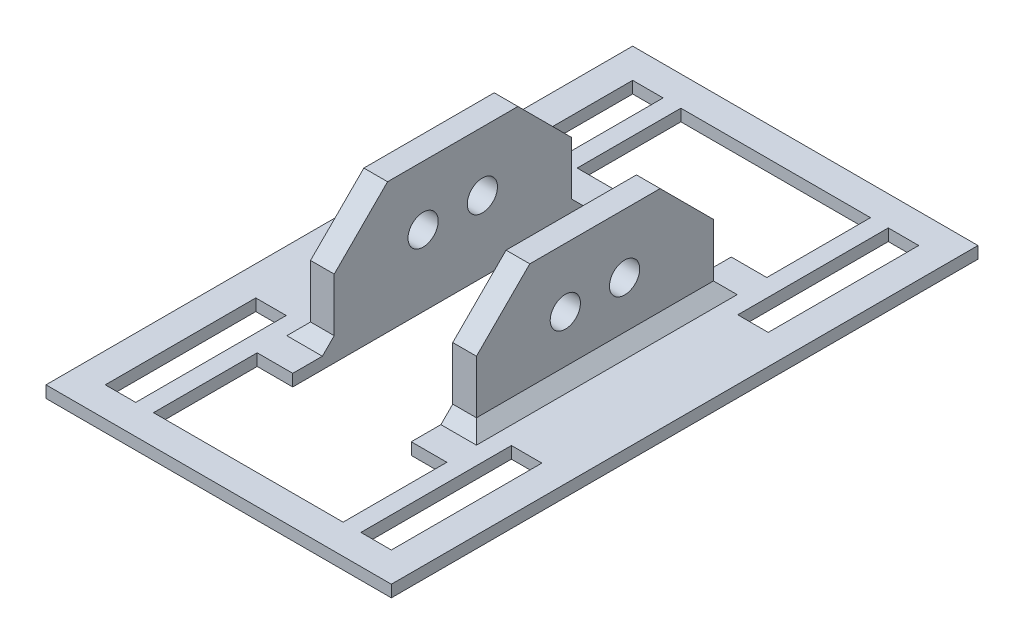
from build123d import *

# Parameters (mm, degrees)
SKETCH1_W           = 58.28
SKETCH1_H           = 99
SKETCH1_W_2         = 5.14
SKETCH1_H_2         = 25.4
BOSS_EXTRUDE1_DEPTH = 2
SKETCH2_W           = 4
SKETCH2_H           = 40
BOSS_EXTRUDE2_DEPTH = 20
CUT_EXTRUDE1_REACH  = 107.741
SKETCH3_R           = 2.55
CHAMFER1_SIZE       = 2
CUT_EXTRUDE2_REACH  = 107.741
CUT_EXTRUDE3_DEPTH  = 2


with BuildPart() as part:
    # Sketch1 → Boss-Extrude1 (new body)
    with BuildSketch(Plane(origin=(0, 0, 0), x_dir=(1, 0, 0), z_dir=(0, 1, 0))):
        with Locations((24.14, 44.5)):
            Rectangle(SKETCH1_W, SKETCH1_H)
        with Locations((2.57, 76.3)):
            Rectangle(SKETCH1_W_2, SKETCH1_H_2, mode=Mode.SUBTRACT)
        with Locations((45.71, 76.3)):
            Rectangle(SKETCH1_W_2, SKETCH1_H_2, mode=Mode.SUBTRACT)
        with Locations((2.57, 12.7)):
            Rectangle(SKETCH1_W_2, SKETCH1_H_2, mode=Mode.SUBTRACT)
        with Locations((45.71, 12.7)):
            Rectangle(SKETCH1_W_2, SKETCH1_H_2, mode=Mode.SUBTRACT)
    extrude(amount=BOSS_EXTRUDE1_DEPTH)

    # Sketch2 → Boss-Extrude2 (add)
    with BuildSketch(Plane(origin=(0, 2, 0), x_dir=(1, 0, 0), z_dir=(0, 1, 0))):
        with Locations((12.14, 44.5)):
            Rectangle(SKETCH2_W, SKETCH2_H)
        with Locations((36.14, 44.5)):
            Rectangle(SKETCH2_W, SKETCH2_H)
    extrude(amount=BOSS_EXTRUDE2_DEPTH)

    # Cut-Extrude1: up to this face of the body (flat: up to its plane)
    cut_extrude1_end = Plane(part.part.faces().sort_by_distance((10.14, 12, -44.5))[0])
    # Sketch3 → Cut-Extrude1 (cut, up to the picked face)
    with BuildSketch(Plane(origin=(38.14, 0, 0), x_dir=(0, 0, -1), z_dir=(1, 0, 0)), mode=Mode.PRIVATE) as cut_extrude1_sk1:
        with Locations((39.5, 12)):
            Circle(SKETCH3_R)
    cut_extrude1_tool1 = split(extrude(cut_extrude1_sk1.sketch, amount=-CUT_EXTRUDE1_REACH, mode=Mode.PRIVATE), bisect_by=cut_extrude1_end, keep=Keep.BOTH, mode=Mode.PRIVATE)
    # Sketch3 → Cut-Extrude1 (cut, up to the picked face)
    with BuildSketch(Plane(origin=(38.14, 0, 0), x_dir=(0, 0, -1), z_dir=(1, 0, 0)), mode=Mode.PRIVATE) as cut_extrude1_sk2:
        with Locations((49.5, 12)):
            Circle(SKETCH3_R)
    cut_extrude1_tool2 = split(extrude(cut_extrude1_sk2.sketch, amount=-CUT_EXTRUDE1_REACH, mode=Mode.PRIVATE), bisect_by=cut_extrude1_end, keep=Keep.BOTH, mode=Mode.PRIVATE)
    add(cut_extrude1_tool1.solids().sort_by(Axis((38.14, 12, -39.5), (-1, 0, 0)))[0], mode=Mode.SUBTRACT)
    add(cut_extrude1_tool2.solids().sort_by(Axis((38.14, 12, -49.5), (-1, 0, 0)))[0], mode=Mode.SUBTRACT)

    # Chamfer1
    chamfer1_edges = [part.edges().sort_by_distance(p)[0] for p in [
        (12.14, 2, -64.5),
        (10.14, 2, -44.5),
        (12.14, 2, -24.5),
        (36.14, 2, -24.5),
        (38.14, 2, -44.5),
        (36.14, 2, -64.5),
    ]]
    chamfer(chamfer1_edges, length=CHAMFER1_SIZE)

    # Cut-Extrude2: up to this face of the body (flat: up to its plane)
    cut_extrude2_end = Plane(part.part.faces().sort_by_distance((38.14, 13.060158725, -44.5))[0])
    # Sketch4 → Cut-Extrude2 (cut, up to the picked face)
    with BuildSketch(Plane.ZY.offset(-10.14), mode=Mode.PRIVATE) as cut_extrude2_sk1:
        Polygon((-55.5, 22), (-64.5, 13), (-64.5, 22), align=None)
    cut_extrude2_tool1 = split(extrude(cut_extrude2_sk1.sketch, amount=-CUT_EXTRUDE2_REACH, mode=Mode.PRIVATE), bisect_by=cut_extrude2_end, keep=Keep.BOTH, mode=Mode.PRIVATE)
    # Sketch4 → Cut-Extrude2 (cut, up to the picked face)
    with BuildSketch(Plane.ZY.offset(-10.14), mode=Mode.PRIVATE) as cut_extrude2_sk2:
        Polygon((-33.5, 22), (-24.5, 13), (-24.5, 22), align=None)
    cut_extrude2_tool2 = split(extrude(cut_extrude2_sk2.sketch, amount=-CUT_EXTRUDE2_REACH, mode=Mode.PRIVATE), bisect_by=cut_extrude2_end, keep=Keep.BOTH, mode=Mode.PRIVATE)
    add(cut_extrude2_tool1.solids().sort_by(Axis((10.14, 19, -61.5), (1, 0, 0)))[0], mode=Mode.SUBTRACT)
    add(cut_extrude2_tool2.solids().sort_by(Axis((10.14, 19, -27.5), (1, 0, 0)))[0], mode=Mode.SUBTRACT)

    # Sketch5 → Cut-Extrude3 (cut)
    with BuildSketch(Plane(origin=(0, 2, 0), x_dir=(1, 0, 0), z_dir=(0, 1, 0))):
        Polygon((34.14, 22.5), (34.14, 66.5), (34.14, 71.5), (40.14, 71.5), (40.14, 89), (8.14, 89), (8.14, 71.5), (14.14, 71.5), (14.14, 66.5), (14.14, 22.5), (14.14, 17.5), (8.14, 17.5), (8.14, 0), (40.14, 0), (40.14, 17.5), (34.14, 17.5), align=None)
    extrude(amount=-CUT_EXTRUDE3_DEPTH, mode=Mode.SUBTRACT)


solid = part.part
